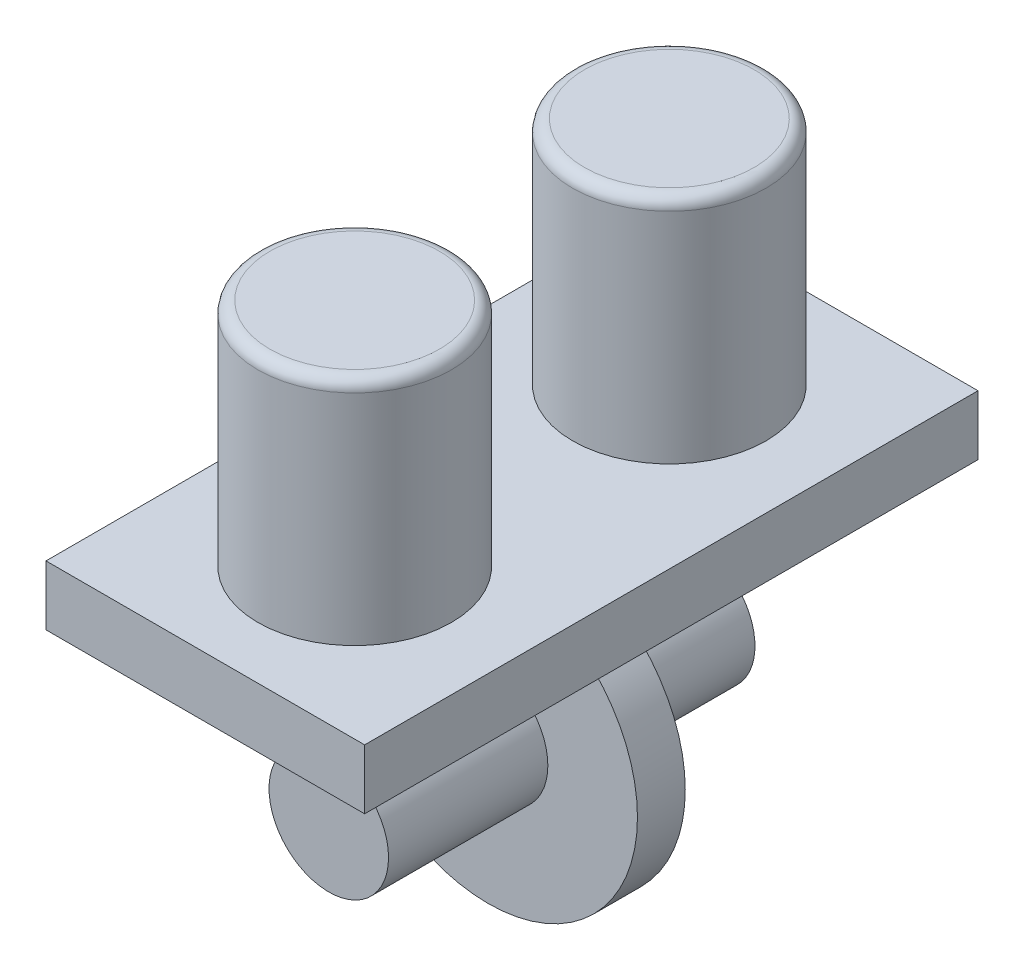
from build123d import *

# Parameters (mm, degrees)
SKETCH1_R             = 95.25
BOSS_EXTRUDE1_DEPTH   = 30.48
SKETCH1_W             = 203.2
SKETCH1_H             = 38.1
BOSS_EXTRUDE1_2_DEPTH = 30.48
SKETCH4_W             = 203.2
SKETCH4_H             = 38.1
BOSS_EXTRUDE2_DEPTH   = 180.34
SKETCH5_W             = 203.2
SKETCH5_H             = 38.1
BOSS_EXTRUDE3_DEPTH   = 180.34
SKETCH6_R             = 38.1
BOSS_EXTRUDE4_DEPTH   = 101.6
BOSS_EXTRUDE5_START   = 101.6
SKETCH7_R             = 38.1
BOSS_EXTRUDE5_DEPTH   = 101.6
SKETCH8_R             = 61.722
BOSS_EXTRUDE6_DEPTH   = 147.1422
FILLET1_R             = 7.62


with BuildPart() as part:
    # Sketch1 → Boss-Extrude1 (new body)
    with BuildSketch(Plane.XY):
        with Locations(Location((0, 0, 0), (0, 0, 180))):
            Circle(SKETCH1_R)
    extrude(amount=BOSS_EXTRUDE1_DEPTH)

    # Sketch6 → Boss-Extrude4 (add)
    with BuildSketch(Plane.XY.offset(30.48)):
        Circle(SKETCH6_R)
    extrude(amount=BOSS_EXTRUDE4_DEPTH)

    # Sketch7 → Boss-Extrude5 (add)
    with BuildSketch(Plane(origin=(0, 0, 0), x_dir=(-1, 0, 0), z_dir=(0, 0, -1)).offset(BOSS_EXTRUDE5_START)):
        with Locations(Location((0, 0, 0), (0, 0, 180))):
            Circle(SKETCH7_R)
    extrude(amount=-BOSS_EXTRUDE5_DEPTH)


with BuildPart() as body_2:
    # Sketch1 → Boss-Extrude1 2 (new body)
    with BuildSketch(Plane.XY):
        with Locations((0, 114.3)):
            Rectangle(SKETCH1_W, SKETCH1_H)
    extrude(amount=BOSS_EXTRUDE1_2_DEPTH)

    # Sketch4 → Boss-Extrude2 (add)
    with BuildSketch(Plane(origin=(0, 0, 0), x_dir=(-1, 0, 0), z_dir=(0, 0, -1))):
        with Locations((0, 114.3)):
            Rectangle(SKETCH4_W, SKETCH4_H)
    extrude(amount=BOSS_EXTRUDE2_DEPTH)

    # Sketch5 → Boss-Extrude3 (add)
    with BuildSketch(Plane.XY.offset(30.48)):
        with Locations((0, 114.3)):
            Rectangle(SKETCH5_W, SKETCH5_H)
    extrude(amount=BOSS_EXTRUDE3_DEPTH)

    # Sketch8 → Boss-Extrude6 (add)
    with BuildSketch(Plane(origin=(0, 133.35, 0), x_dir=(1, 0, 0), z_dir=(0, 1, 0))):
        with Locations(Location((0, -115.57, 0), (0, 0, 270))):
            Circle(SKETCH8_R)
        with Locations(Location((0, 85.09, 0), (0, 0, 270))):
            Circle(SKETCH8_R)
    extrude(amount=BOSS_EXTRUDE6_DEPTH)

    # Fillet1
    fillet1_edges = [body_2.edges().sort_by_distance(p)[0] for p in [
        (0, 280.4922, 53.848),
        (0, 280.4922, -146.812),
    ]]
    fillet(fillet1_edges, radius=FILLET1_R)


solid = Compound([part.part, body_2.part])
